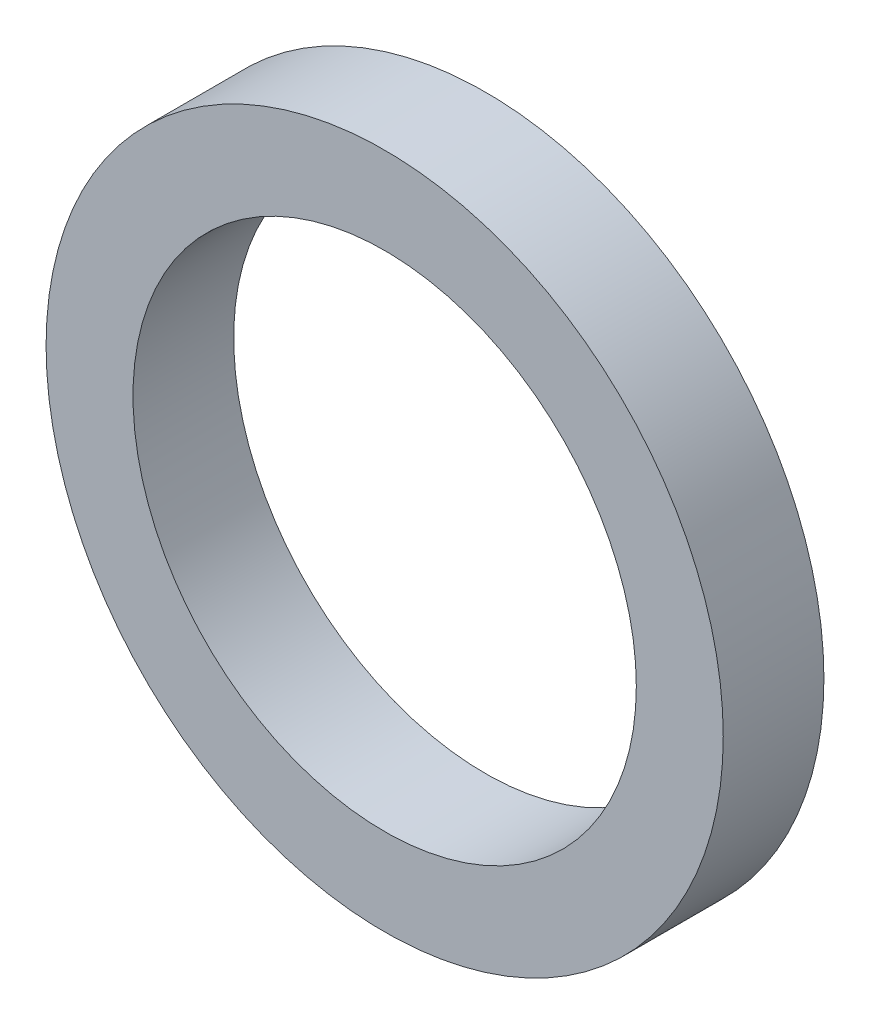
from build123d import *

# Parameters (mm, degrees)
SKETCH1_R           = 23.495
SKETCH1_R_2         = 17.4625
BOSS_EXTRUDE1_DEPTH = 6.985


with BuildPart() as part:
    # Sketch1 → Boss-Extrude1 (new body)
    with BuildSketch(Plane.XY):
        with Locations((-21.15, -21.15)):
            Circle(SKETCH1_R)
        with Locations((-21.15, -21.15)):
            Circle(SKETCH1_R_2, mode=Mode.SUBTRACT)
    extrude(amount=BOSS_EXTRUDE1_DEPTH)


solid = part.part
